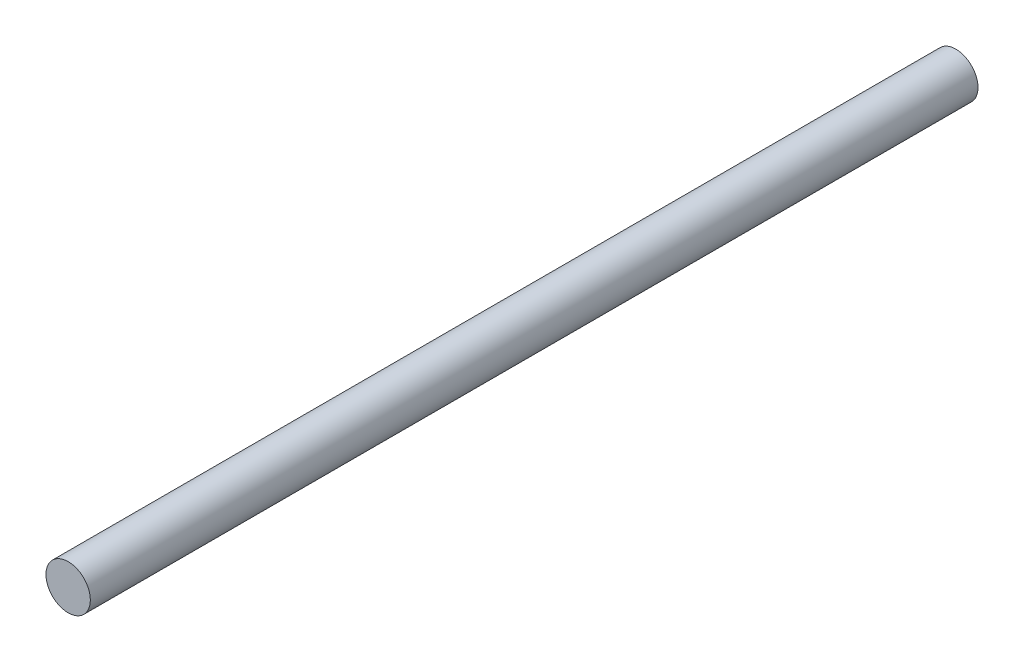
from build123d import *

# Parameters (mm, degrees)
CROQUIS1_R              = 2.5
SALIENTE_EXTRUIR1_DEPTH = 100


with BuildPart() as part:
    # Croquis1 → Saliente-Extruir1 (new body)
    with BuildSketch(Plane.XY):
        Circle(CROQUIS1_R)
    extrude(amount=-SALIENTE_EXTRUIR1_DEPTH)


solid = part.part
